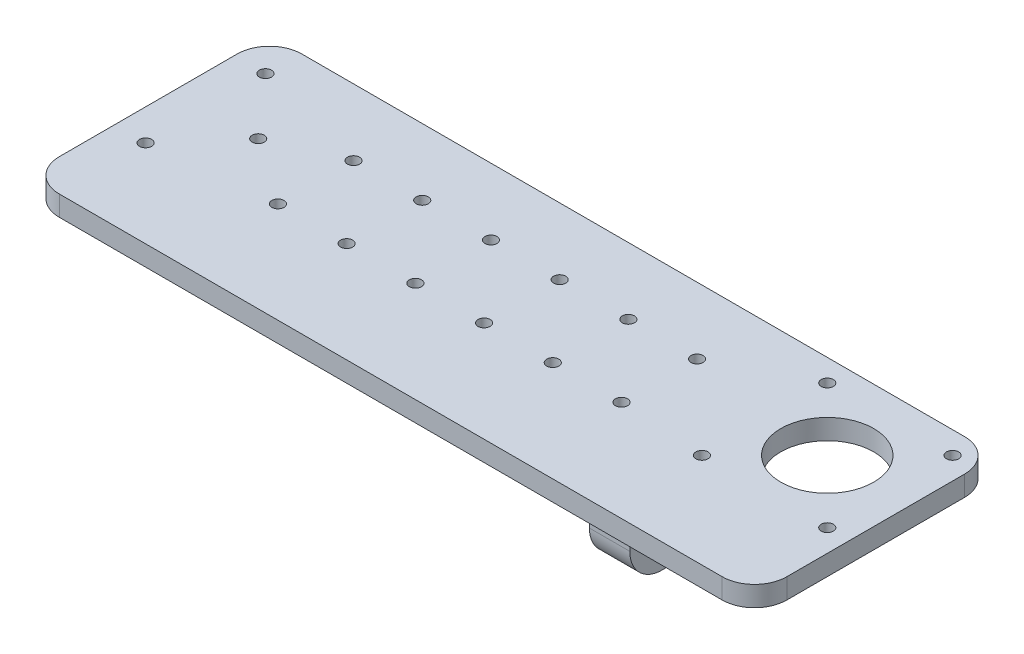
from build123d import *

# Parameters (mm, degrees)
SKETCH_1_W           = 180
SKETCH_1_H           = 60
SKETCH_1_R           = 11
SKETCH_1_R_2         = 1.5
EXTRUDE_3_DEPTH      = 5
SKETCH_2_W           = 10
SKETCH_2_H           = 20
EXTRUDE_4_DEPTH      = 20
SKETCH_4_R           = 4
CUT_EXTRUDE_1_DEPTH  = 20
SKETCH_8_W           = 3
SKETCH_8_H           = 20
CUT_EXTRUDE_4_DEPTH  = 10
SKETCH_10_W          = 14
SKETCH_10_H          = 20
EXTRUDE_5_DEPTH      = 10
SKETCH_9_R           = 4
CUT_EXTRUDE_5_DEPTH  = 10
SKETCH_12_W          = 13.5
SKETCH_12_H          = 20
CUT_EXTRUDE_6_DEPTH  = 10
SKETCH_15_W          = 1
SKETCH_15_H          = 20
CUT_EXTRUDE_7_DEPTH  = 10
FILLET_5_R           = 5
SKETCH_21_W          = 10
SKETCH_21_H          = 18
EXTRUDE_6_DEPTH      = 20
SKETCH_23_R          = 4
CUT_EXTRUDE_9_DEPTH  = 20
FILLET_8_R           = 8
SKETCH_25_W          = 11.311173877
SKETCH_25_H          = 1.5
CUT_EXTRUDE_10_DEPTH = 20
FILLET_9_R           = 8
SKETCH_28_W          = 10
SKETCH_28_H          = 16.5
EXTRUDE_7_DEPTH      = 25
SKETCH_31_W          = 27.629977972
SKETCH_31_H          = 33.342762348
CUT_EXTRUDE_12_DEPTH = 20
SKETCH_33_W          = 10
SKETCH_33_H          = 20
EXTRUDE_8_DEPTH      = 6
SKETCH_34_W          = 10
SKETCH_34_H          = 20
CUT_EXTRUDE_13_DEPTH = 6
SKETCH_35_R          = 4
CUT_EXTRUDE_14_DEPTH = 10
FILLET_11_R          = 8
SKETCH_36_R          = 1.5
CUT_EXTRUDE_15_DEPTH = 10
SKETCH_37_R          = 4.5
CUT_EXTRUDE_16_DEPTH = 10
SKETCH_38_R          = 11.5
CUT_EXTRUDE_17_DEPTH = 10
SKETCH_39_R          = 1.5
CUT_EXTRUDE_18_DEPTH = 10
FILLET_13_R          = 8


with BuildPart() as part:
    # 스케치1 → 보스-돌출3 (new body)
    with BuildSketch(Plane(origin=(0, 0, 0), x_dir=(1, 0, 0), z_dir=(0, 1, 0))):
        with Locations((36.632340007, -1.742375967)):
            Rectangle(SKETCH_1_W, SKETCH_1_H)
        with Locations(Location((105.632340007, 7.257624033, 0), (0, 0, 270))):
            Circle(SKETCH_1_R, mode=Mode.SUBTRACT)
        with Locations(Location((90.132340007, 22.757624033, 0), (0, 0, 270))):
            Circle(SKETCH_1_R_2, mode=Mode.SUBTRACT)
        with Locations(Location((121.132340007, 22.757624033, 0), (0, 0, 270))):
            Circle(SKETCH_1_R_2, mode=Mode.SUBTRACT)
        with Locations(Location((90.132340007, -8.242375967, 0), (0, 0, 270))):
            Circle(SKETCH_1_R_2, mode=Mode.SUBTRACT)
        with Locations(Location((121.132340007, -8.242375967, 0), (0, 0, 270))):
            Circle(SKETCH_1_R_2, mode=Mode.SUBTRACT)
        with Locations(Location((-32.617755763, 4.712595626, 0), (0, 0, 270))):
            Circle(SKETCH_1_R_2, mode=Mode.SUBTRACT)
        with Locations(Location((-45.654401225, 19.548720133, 0), (0, 0, 270))):
            Circle(SKETCH_1_R_2, mode=Mode.SUBTRACT)
        with Locations(Location((-45.654401225, -10.123528882, 0), (0, 0, 270))):
            Circle(SKETCH_1_R_2, mode=Mode.SUBTRACT)
    extrude(amount=EXTRUDE_3_DEPTH)

    # 스케치2 → 보스-돌출4 (add)
    with BuildSketch(Plane(origin=(0, 5, 0), x_dir=(1, 0, 0), z_dir=(0, 1, 0))):
        with Locations((79.782459712, 8.257624033)):
            Rectangle(SKETCH_2_W, SKETCH_2_H)
    extrude(amount=EXTRUDE_4_DEPTH)

    # 스케치4 → 컷-돌출1 (cut)
    with BuildSketch(Plane.ZY.offset(-74.782459712)):
        with Locations((-8.257624033, 15)):
            Circle(SKETCH_4_R)
    extrude(amount=-CUT_EXTRUDE_1_DEPTH, mode=Mode.SUBTRACT)

    # 스케치8 → 컷-돌출4 (cut)
    with BuildSketch(Plane(origin=(84.782459712, 0, 0), x_dir=(0, 0, -1), z_dir=(1, 0, 0))):
        with Locations((16.757624033, 15)):
            Rectangle(SKETCH_8_W, SKETCH_8_H)
        with Locations((-0.242375967, 15)):
            Rectangle(SKETCH_8_W, SKETCH_8_H)
    extrude(amount=-CUT_EXTRUDE_4_DEPTH, mode=Mode.SUBTRACT)

    # 스케치10 → 보스-돌출5 (add)
    with BuildSketch(Plane(origin=(84.782459712, 0, 0), x_dir=(0, 0, -1), z_dir=(1, 0, 0))):
        with Locations((-5.242375967, 15)):
            Rectangle(SKETCH_10_W, SKETCH_10_H)
    extrude(amount=-EXTRUDE_5_DEPTH)

    # 스케치9 → 컷-돌출5 (cut)
    with BuildSketch(Plane(origin=(84.782459712, 0, 0), x_dir=(0, 0, -1), z_dir=(1, 0, 0))):
        with Locations((-5.242375967, 15)):
            Circle(SKETCH_9_R)
    extrude(amount=-CUT_EXTRUDE_5_DEPTH, mode=Mode.SUBTRACT)

    # 스케치12 → 컷-돌출6 (cut)
    with BuildSketch(Plane(origin=(84.782459712, 0, 0), x_dir=(0, 0, -1), z_dir=(1, 0, 0))):
        with Locations((8.507624033, 15)):
            Rectangle(SKETCH_12_W, SKETCH_12_H)
    extrude(amount=-CUT_EXTRUDE_6_DEPTH, mode=Mode.SUBTRACT)

    # 스케치15 → 컷-돌출7 (cut)
    with BuildSketch(Plane(origin=(84.782459712, 0, 0), x_dir=(0, 0, -1), z_dir=(1, 0, 0))):
        with Locations((1.257624033, 15)):
            Rectangle(SKETCH_15_W, SKETCH_15_H)
    extrude(amount=-CUT_EXTRUDE_7_DEPTH, mode=Mode.SUBTRACT)

    # 필렛5
    fillet_5_edges = [part.edges().sort_by_distance(p)[0] for p in [
        (79.782459712, 25, -0.757624033),
        (79.782459712, 25, 12.242375967),
    ]]
    fillet(fillet_5_edges, radius=FILLET_5_R)

    # 스케치21 → 보스-돌출6 (add)
    with BuildSketch(Plane(origin=(0, 5, 0), x_dir=(1, 0, 0), z_dir=(0, 1, 0))):
        with Locations((79.782459712, -5.742375967)):
            Rectangle(SKETCH_21_W, SKETCH_21_H)
    extrude(amount=EXTRUDE_6_DEPTH)

    # 스케치23 → 컷-돌출9 (cut)
    with BuildSketch(Plane(origin=(84.782459712, 0, 0), x_dir=(0, 0, -1), z_dir=(1, 0, 0))):
        with Locations((-5.742375967, 15)):
            Circle(SKETCH_23_R)
    extrude(amount=-CUT_EXTRUDE_9_DEPTH, mode=Mode.SUBTRACT)

    # 필렛8
    fillet_8_edges = [part.edges().sort_by_distance(p)[0] for p in [
        (79.782459712, 5, 14.742375967),
    ]]
    fillet(fillet_8_edges, radius=FILLET_8_R)

    # 스케치25 → 컷-돌출10 (cut)
    with BuildSketch(Plane(origin=(0, 5, 0), x_dir=(1, 0, 0), z_dir=(0, 1, 0))):
        with Locations((79.126872773, 2.507624033)):
            Rectangle(SKETCH_25_W, SKETCH_25_H)
    extrude(amount=CUT_EXTRUDE_10_DEPTH, mode=Mode.SUBTRACT)

    # 필렛9
    fillet_9_edges = [part.edges().sort_by_distance(p)[0] for p in [
        (79.782459712, 25, 14.742375967),
        (79.782459712, 25, -1.757624033),
    ]]
    fillet(fillet_9_edges, radius=FILLET_9_R)

    # 스케치28 → 보스-돌출7 (add)
    with BuildSketch(Plane(origin=(0, 5, 0), x_dir=(1, 0, 0), z_dir=(0, 1, 0))):
        with Locations((79.782459712, -6.492375967)):
            Rectangle(SKETCH_28_W, SKETCH_28_H)
    extrude(amount=-EXTRUDE_7_DEPTH)

    # 스케치31 → 컷-돌출12 (cut)
    with BuildSketch(Plane(origin=(0, 5, 0), x_dir=(1, 0, 0), z_dir=(0, 1, 0))):
        with Locations((71.963070495, -8.53095436)):
            Rectangle(SKETCH_31_W, SKETCH_31_H)
    extrude(amount=CUT_EXTRUDE_12_DEPTH, mode=Mode.SUBTRACT)

    # 스케치33 → 보스-돌출8 (add)
    with BuildSketch(Plane.XY.offset(14.742375967)):
        with Locations((79.782459712, -10)):
            Rectangle(SKETCH_33_W, SKETCH_33_H)
    extrude(amount=EXTRUDE_8_DEPTH)

    # 스케치34 → 컷-돌출13 (cut)
    with BuildSketch(Plane(origin=(0, 0, -1.757624033), x_dir=(-1, 0, 0), z_dir=(0, 0, -1))):
        with Locations((-79.782459712, -10)):
            Rectangle(SKETCH_34_W, SKETCH_34_H)
    extrude(amount=-CUT_EXTRUDE_13_DEPTH, mode=Mode.SUBTRACT)

    # 스케치35 → 컷-돌출14 (cut)
    with BuildSketch(Plane(origin=(84.782459712, 0, 0), x_dir=(0, 0, -1), z_dir=(1, 0, 0))):
        with Locations((-11.742375967, -10)):
            Circle(SKETCH_35_R)
    extrude(amount=-CUT_EXTRUDE_14_DEPTH, mode=Mode.SUBTRACT)

    # 필렛11
    fillet_11_edges = [part.edges().sort_by_distance(p)[0] for p in [
        (79.782459712, 0, 20.742375967),
        (79.782459712, -20, 20.742375967),
        (79.782459712, -20, 4.242375967),
    ]]
    fillet(fillet_11_edges, radius=FILLET_11_R)

    # 스케치36 → 컷-돌출15 (cut)
    with BuildSketch(Plane.XZ):
        with Locations(Location((-16.194092027, 6.822922113, 0), (0, 0, 270))):
            Circle(SKETCH_36_R)
        with Locations(Location((-16.114067961, -11.797077887, 0), (0, 0, 270))):
            Circle(SKETCH_36_R)
        with Locations(Location((0.805907973, 6.822922113, 0), (0, 0, 270))):
            Circle(SKETCH_36_R)
        with Locations(Location((0.885932039, -11.797077887, 0), (0, 0, 270))):
            Circle(SKETCH_36_R)
        with Locations(Location((17.805907973, 6.822922113, 0), (0, 0, 270))):
            Circle(SKETCH_36_R)
        with Locations(Location((17.885932039, -11.797077887, 0), (0, 0, 270))):
            Circle(SKETCH_36_R)
        with Locations(Location((34.805907973, 6.822922113, 0), (0, 0, 270))):
            Circle(SKETCH_36_R)
        with Locations(Location((34.885932039, -11.797077887, 0), (0, 0, 270))):
            Circle(SKETCH_36_R)
        with Locations(Location((51.805907973, 6.822922113, 0), (0, 0, 270))):
            Circle(SKETCH_36_R)
        with Locations(Location((51.885932039, -11.797077887, 0), (0, 0, 270))):
            Circle(SKETCH_36_R)
        with Locations(Location((68.805907973, 6.822922113, 0), (0, 0, 270))):
            Circle(SKETCH_36_R)
        with Locations(Location((68.885932039, -11.797077887, 0), (0, 0, 270))):
            Circle(SKETCH_36_R)
    extrude(amount=-CUT_EXTRUDE_15_DEPTH, mode=Mode.SUBTRACT)

    # 스케치37 → 컷-돌출16 (cut)
    with BuildSketch(Plane(origin=(84.782459712, 0, 0), x_dir=(0, 0, -1), z_dir=(1, 0, 0))):
        with Locations((-11.742375967, -10)):
            Circle(SKETCH_37_R)
    extrude(amount=-CUT_EXTRUDE_16_DEPTH, mode=Mode.SUBTRACT)

    # 스케치38 → 컷-돌출17 (cut)
    with BuildSketch(Plane.XZ):
        with Locations(Location((105.632340007, -7.257624033, 0), (0, 0, 270))):
            Circle(SKETCH_38_R)
    extrude(amount=-CUT_EXTRUDE_17_DEPTH, mode=Mode.SUBTRACT)

    # 스케치39 → 컷-돌출18 (cut)
    with BuildSketch(Plane(origin=(0, 0, 4.242375967), x_dir=(-1, 0, 0), z_dir=(0, 0, -1))):
        with Locations((-79.782459712, -9.106275905)):
            Circle(SKETCH_39_R)
    extrude(amount=-CUT_EXTRUDE_18_DEPTH, mode=Mode.SUBTRACT)

    # 필렛13
    fillet_13_edges = [part.edges().sort_by_distance(p)[0] for p in [
        (126.632340007, 2.5, -28.257624033),
        (126.632340007, 2.5, 31.742375967),
        (-53.367659993, 2.5, 31.742375967),
        (-53.367659993, 2.5, -28.257624033),
    ]]
    fillet(fillet_13_edges, radius=FILLET_13_R)


solid = part.part
